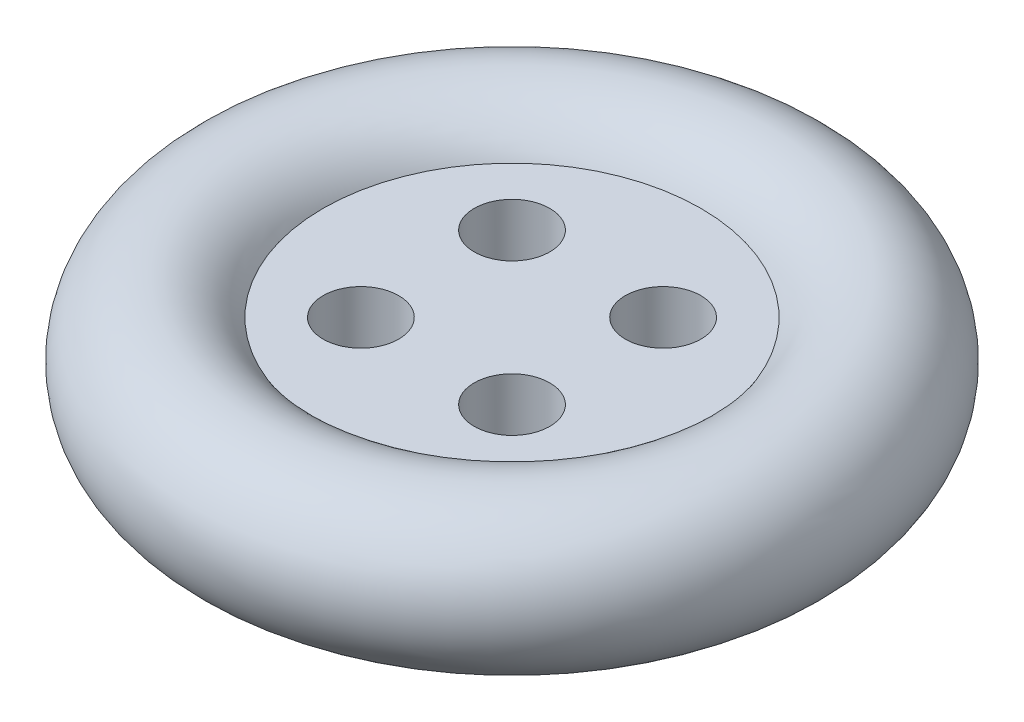
from build123d import *

# Parameters (mm, degrees)
CUT_EXTRUDE1_DEPTH      = 59.159460492
CUT_EXTRUDE1_DEPTH_BACK = 59.159460492
SKETCH3_R               = 4


with BuildPart() as part:
    # Sketch2 → Revolve1 (revolve)
    with BuildSketch(Plane(origin=(0, 0, 0), x_dir=(0, 0, -1), z_dir=(1, 0, 0)), mode=Mode.PRIVATE) as revolve1_sk:
        with BuildLine():
            Line((-10, 4), (10, 4))
            ThreePointArc((10, 4), (24.92820323, 0), (10, -4))
            Line((10, -4), (-10, -4))
            Line((-10, -4), (-10, 4))
        make_face()
    revolve(revolve1_sk.sketch.rotate(Axis((0, 4, 10), (0, -1, 0)), 180), axis=Axis((0, 4, 10), (0, -1, 0)))

    # Sketch3 → Cut-Extrude1 (cut, two sides: drawn at the far end of the back side and taken through both)
    with BuildSketch(Plane(origin=(0, 4, 0), x_dir=(1, 0, 0), z_dir=(0, 1, 0)).offset(-CUT_EXTRUDE1_DEPTH_BACK)):
        with Locations(Location((-8, -2, 0), (0, 0, 90))):
            Circle(SKETCH3_R)
        with Locations(Location((8, -2, 0), (0, 0, 90))):
            Circle(SKETCH3_R)
        with Locations(Location((8, -18, 0), (0, 0, 90))):
            Circle(SKETCH3_R)
        with Locations(Location((-8, -18, 0), (0, 0, 90))):
            Circle(SKETCH3_R)
    extrude(amount=CUT_EXTRUDE1_DEPTH + CUT_EXTRUDE1_DEPTH_BACK, mode=Mode.SUBTRACT)


solid = part.part
